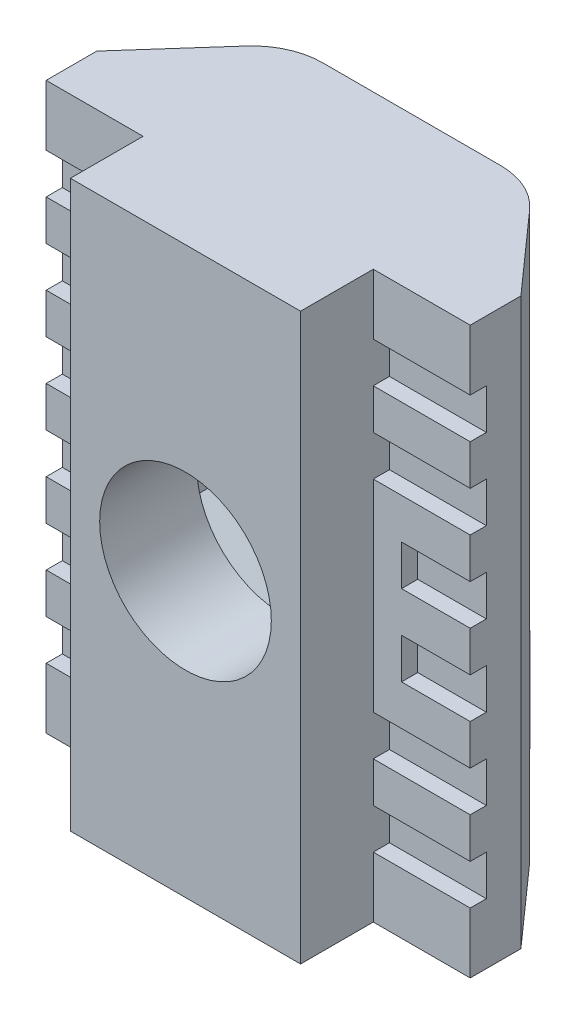
from build123d import *

# Parameters (mm, degrees)
BOSS_EXTRUDE1_DEPTH = 14
CUT_EXTRUDE1_DEPTH  = 3.2
SKETCH4_W           = 0.4
SKETCH4_H           = 1
CUT_EXTRUDE3_DEPTH  = 17.414932226
BOSS_EXTRUDE2_START = -3.2
BOSS_EXTRUDE2_DEPTH = 0.6
SKETCH3_R           = 2.125
CUT_EXTRUDE2_DEPTH  = 16.966292619


with BuildPart() as part:
    # Sketch1 → Boss-Extrude1 (new body)
    with BuildSketch(Plane(origin=(0, 0, 0), x_dir=(1, 0, 0), z_dir=(0, 1, 0))):
        with BuildLine():
            Line((-3.509834179, 2.212636718), (-5.25, 0.254950169))
            Line((-5.25, 0.254950169), (-5.25, -1))
            Line((-5.25, -1), (-2.85, -1))
            Line((-2.85, -1), (-2.85, -2.8))
            Line((-2.85, -2.8), (2.85, -2.8))
            Line((2.85, -2.8), (2.85, -1))
            Line((2.85, -1), (5.25, -1))
            Line((5.25, -1), (5.25, 0.254950169))
            Line((5.25, 0.254950169), (3.509834179, 2.212636718))
            ThreePointArc((3.509834179, 2.212636718), (2.918765962, 2.646420098), (2.201867871, 2.8))
            Line((2.201867871, 2.8), (-2.201867871, 2.8))
            ThreePointArc((-2.201867871, 2.8), (-2.918765962, 2.646420098), (-3.509834179, 2.212636718))
        make_face()
    extrude(amount=BOSS_EXTRUDE1_DEPTH)

    # Sketch2 → Cut-Extrude1 (cut)
    with BuildSketch(Plane(origin=(0, 0, -2.8), x_dir=(-1, 0, 0), z_dir=(0, 0, -1))):
        Polygon((-3.55, 4.950406544), (0, 2.900813089), (3.55, 4.950406544), (3.55, 9.049593456), (0, 11.099186911), (-3.55, 9.049593456), align=None)
    extrude(amount=-CUT_EXTRUDE1_DEPTH, mode=Mode.SUBTRACT)

    # Sketch4 → Cut-Extrude3 (cut, through all)
    with BuildSketch(Plane.ZY.offset(2.85)):
        with Locations((0.8, 12)):
            Rectangle(SKETCH4_W, SKETCH4_H)
        with Locations((0.8, 10)):
            Rectangle(SKETCH4_W, SKETCH4_H)
        with Locations((0.8, 8)):
            Rectangle(SKETCH4_W, SKETCH4_H)
        with Locations((0.8, 6)):
            Rectangle(SKETCH4_W, SKETCH4_H)
        with Locations((0.8, 4)):
            Rectangle(SKETCH4_W, SKETCH4_H)
        with Locations((0.8, 2)):
            Rectangle(SKETCH4_W, SKETCH4_H)
    cut_extrude3 = extrude(amount=CUT_EXTRUDE3_DEPTH, mode=Mode.SUBTRACT)

    # Mirror1: Cut-Extrude3 across plane
    add(cut_extrude3.mirror(Plane(origin=(0, 0, 0), x_dir=(0, 0, 1), z_dir=(1, 0, 0))), mode=Mode.SUBTRACT)

    # Sketch2<2> → Boss-Extrude2 (add)
    with BuildSketch(Plane(origin=(0, 0, -2.8), x_dir=(-1, 0, 0), z_dir=(0, 0, -1)).offset(BOSS_EXTRUDE2_START)):
        Polygon((-3.55, 4.950406544), (0, 2.900813089), (3.55, 4.950406544), (3.55, 9.049593456), (0, 11.099186911), (-3.55, 9.049593456), align=None)
    extrude(amount=-BOSS_EXTRUDE2_DEPTH)

    # Sketch3 → Cut-Extrude2 (cut, through all)
    with BuildSketch(Plane.XY.offset(2.8)):
        with Locations((0, 7)):
            Circle(SKETCH3_R)
    extrude(amount=-CUT_EXTRUDE2_DEPTH, mode=Mode.SUBTRACT)


solid = part.part
